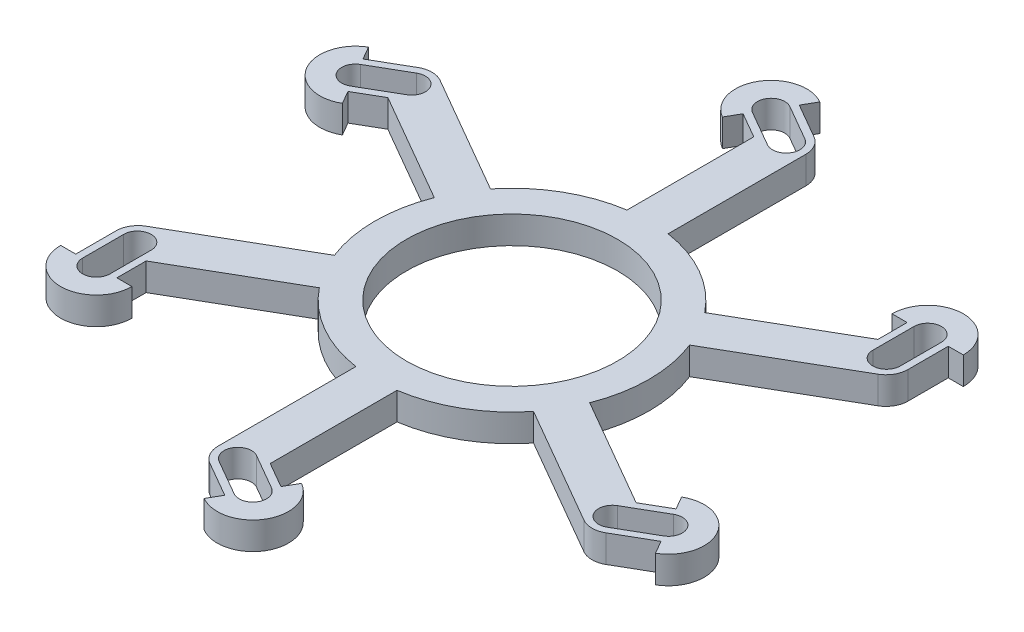
from build123d import *

# Parameters (mm, degrees)
SKETCH1_R           = 38.5
BOSS_EXTRUDE1_DEPTH = 10


with BuildPart() as part:
    # Sketch1 → Boss-Extrude1 (new body)
    with BuildSketch(Plane(origin=(0, 0, 0), x_dir=(1, 0, 0), z_dir=(0, 1, 0))):
        with BuildLine():
            Line((7.5, 49.434299833), (7.5, 99.718353376))
            ThreePointArc((7.5, 99.718353376), (6.42820323, 103.718353376), (3.5, 106.646556606))
            Line((3.5, 106.646556606), (-9.237337622, 114.000461911))
            Line((-9.237337622, 114.000461911), (-6.490381057, 118.758330249))
            ThreePointArc((-6.490381057, 118.758330249), (-24.248711306, 114), (-19.490381057, 96.241669751))
            Line((-19.490381057, 96.241669751), (-16.737337622, 101.010080854))
            Line((-16.737337622, 101.010080854), (-7.5, 95.676901492))
            Line((-7.5, 95.676901492), (-7.5, 49.434299833))
            ThreePointArc((-7.5, 49.434299833), (-25, 43.301270189), (-39.061359474, 31.212340445))
            Line((-39.061359474, 31.212340445), (-82.608627247, 56.354367216))
            ThreePointArc((-82.608627247, 56.354367216), (-86.608627247, 57.426163986), (-90.608627247, 56.354367216))
            Line((-90.608627247, 56.354367216), (-103.34596487, 49.000461911))
            Line((-103.34596487, 49.000461911), (-106.092921435, 53.758330249))
            ThreePointArc((-106.092921435, 53.758330249), (-110.851251684, 36), (-93.092921435, 31.241669751))
            Line((-93.092921435, 31.241669751), (-95.84596487, 36.010080854))
            Line((-95.84596487, 36.010080854), (-86.608627247, 41.343260217))
            Line((-86.608627247, 41.343260217), (-46.561359474, 18.221959388))
            ThreePointArc((-46.561359474, 18.221959388), (-50, 0), (-46.561359474, -18.221959388))
            Line((-46.561359474, -18.221959388), (-90.108627247, -43.36398616))
            ThreePointArc((-90.108627247, -43.36398616), (-93.036830477, -46.29218939), (-94.108627247, -50.29218939))
            Line((-94.108627247, -50.29218939), (-94.108627247, -65))
            Line((-94.108627247, -65), (-99.602540378, -65))
            ThreePointArc((-99.602540378, -65), (-86.602540378, -78), (-73.602540378, -65))
            Line((-73.602540378, -65), (-79.108627247, -65))
            Line((-79.108627247, -65), (-79.108627247, -54.333641274))
            Line((-79.108627247, -54.333641274), (-39.061359474, -31.212340445))
            ThreePointArc((-39.061359474, -31.212340445), (-25, -43.301270189), (-7.5, -49.434299833))
            Line((-7.5, -49.434299833), (-7.5, -99.718353376))
            ThreePointArc((-7.5, -99.718353376), (-6.42820323, -103.718353376), (-3.5, -106.646556606))
            Line((-3.5, -106.646556606), (9.237337622, -114.000461911))
            Line((9.237337622, -114.000461911), (6.490381057, -118.758330249))
            ThreePointArc((6.490381057, -118.758330249), (24.248711306, -114), (19.490381057, -96.241669751))
            Line((19.490381057, -96.241669751), (16.737337622, -101.010080854))
            Line((16.737337622, -101.010080854), (7.5, -95.676901492))
            Line((7.5, -95.676901492), (7.5, -49.434299833))
            ThreePointArc((7.5, -49.434299833), (25, -43.301270189), (39.061359474, -31.212340445))
            Line((39.061359474, -31.212340445), (82.608627247, -56.354367216))
            ThreePointArc((82.608627247, -56.354367216), (86.608627247, -57.426163986), (90.608627247, -56.354367216))
            Line((90.608627247, -56.354367216), (103.34596487, -49.000461911))
            Line((103.34596487, -49.000461911), (106.092921435, -53.758330249))
            ThreePointArc((106.092921435, -53.758330249), (110.851251684, -36), (93.092921435, -31.241669751))
            Line((93.092921435, -31.241669751), (95.84596487, -36.010080854))
            Line((95.84596487, -36.010080854), (86.608627247, -41.343260217))
            Line((86.608627247, -41.343260217), (46.561359474, -18.221959388))
            ThreePointArc((46.561359474, -18.221959388), (50, 0), (46.561359474, 18.221959388))
            Line((46.561359474, 18.221959388), (90.108627247, 43.36398616))
            ThreePointArc((90.108627247, 43.36398616), (93.036830477, 46.29218939), (94.108627247, 50.29218939))
            Line((94.108627247, 50.29218939), (94.108627247, 65))
            Line((94.108627247, 65), (99.602540378, 65))
            ThreePointArc((99.602540378, 65), (86.602540378, 78), (73.602540378, 65))
            Line((73.602540378, 65), (79.108627247, 65))
            Line((79.108627247, 65), (79.108627247, 54.333641274))
            Line((79.108627247, 54.333641274), (39.061359474, 31.212340445))
            ThreePointArc((39.061359474, 31.212340445), (25, 43.301270189), (7.5, 49.434299833))
        make_face()
        with Locations(Location((0, 0, 0), (0, 0, 270))):
            Circle(SKETCH1_R, mode=Mode.SUBTRACT)
        with BuildLine():
            Line((-10.490381057, 111.830127019), (2.5, 104.330127019))
            ThreePointArc((2.5, 104.330127019), (4.330127019, 97.5), (-2.5, 95.669872981))
            Line((-2.5, 95.669872981), (-15.490381057, 103.169872981))
            ThreePointArc((-15.490381057, 103.169872981), (-17.320508076, 110), (-10.490381057, 111.830127019))
        make_face(mode=Mode.SUBTRACT)
        with BuildLine():
            Line((91.602540378, 65), (91.602540378, 50))
            ThreePointArc((91.602540378, 50), (86.602540378, 45), (81.602540378, 50))
            Line((81.602540378, 50), (81.602540378, 65))
            ThreePointArc((81.602540378, 65), (86.602540378, 70), (91.602540378, 65))
        make_face(mode=Mode.SUBTRACT)
        with BuildLine():
            Line((102.092921435, -46.830127019), (89.102540378, -54.330127019))
            ThreePointArc((89.102540378, -54.330127019), (82.27241336, -52.5), (84.102540378, -45.669872981))
            Line((84.102540378, -45.669872981), (97.092921435, -38.169872981))
            ThreePointArc((97.092921435, -38.169872981), (103.923048454, -40), (102.092921435, -46.830127019))
        make_face(mode=Mode.SUBTRACT)
        with BuildLine():
            Line((10.490381057, -111.830127019), (-2.5, -104.330127019))
            ThreePointArc((-2.5, -104.330127019), (-4.330127019, -97.5), (2.5, -95.669872981))
            Line((2.5, -95.669872981), (15.490381057, -103.169872981))
            ThreePointArc((15.490381057, -103.169872981), (17.320508076, -110), (10.490381057, -111.830127019))
        make_face(mode=Mode.SUBTRACT)
        with BuildLine():
            Line((-91.602540378, -65), (-91.602540378, -50))
            ThreePointArc((-91.602540378, -50), (-86.602540378, -45), (-81.602540378, -50))
            Line((-81.602540378, -50), (-81.602540378, -65))
            ThreePointArc((-81.602540378, -65), (-86.602540378, -70), (-91.602540378, -65))
        make_face(mode=Mode.SUBTRACT)
        with BuildLine():
            Line((-102.092921435, 46.830127019), (-89.102540378, 54.330127019))
            ThreePointArc((-89.102540378, 54.330127019), (-82.27241336, 52.5), (-84.102540378, 45.669872981))
            Line((-84.102540378, 45.669872981), (-97.092921435, 38.169872981))
            ThreePointArc((-97.092921435, 38.169872981), (-103.923048454, 40), (-102.092921435, 46.830127019))
        make_face(mode=Mode.SUBTRACT)
    extrude(amount=BOSS_EXTRUDE1_DEPTH)


solid = part.part
